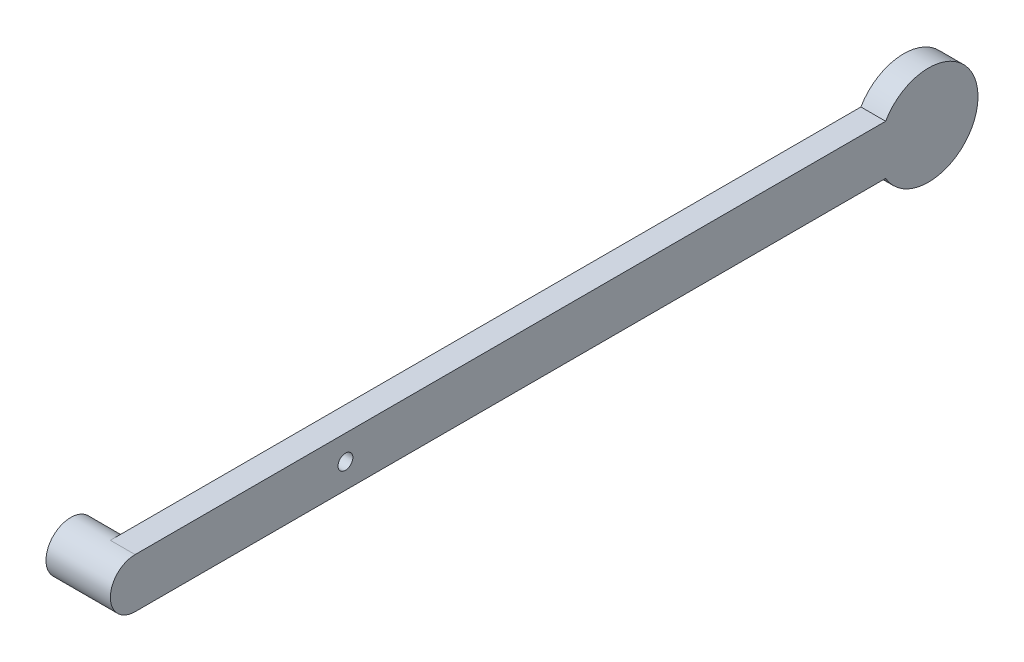
from build123d import *

# Parameters (mm, degrees)
ESBO_O1_R                = 1.5
RESSALTO_EXTRUS_O1_DEPTH = 5
RESSALTO_EXTRUS_O2_START = 8
ESBO_O2_R                = 5
RESSALTO_EXTRUS_O2_DEPTH = 8
ESBO_O3_R                = 10
RESSALTO_EXTRUS_O3_DEPTH = 5


with BuildPart() as part:
    # Esboço1 → Ressalto-extrusão1 (new body)
    with BuildSketch(Plane.YZ):
        with BuildLine():
            Line((5, 42.5), (5, -117.8))
            ThreePointArc((5, -117.8), (0, -122.8), (-5, -117.8))
            Line((-5, -117.8), (-5, 42.5))
            ThreePointArc((-5, 42.5), (0, 47.5), (5, 42.5))
        make_face()
        with Locations(Location((0, 0, 0), (0, 0, 270))):
            Circle(ESBO_O1_R, mode=Mode.SUBTRACT)
    extrude(amount=RESSALTO_EXTRUS_O1_DEPTH)

    # Esboço2 → Ressalto-extrusão2 (add)
    with BuildSketch(Plane(origin=(0, 0, 0), x_dir=(0, -1, 0), z_dir=(-1, 0, 0)).offset(RESSALTO_EXTRUS_O2_START)):
        with Locations(Location((0, 42.5, 0), (0, 0, 90))):
            Circle(ESBO_O2_R)
    extrude(amount=-RESSALTO_EXTRUS_O2_DEPTH)

    # Esboço3 → Ressalto-extrusão3 (add)
    with BuildSketch(Plane(origin=(0, 0, 0), x_dir=(0, -1, 0), z_dir=(-1, 0, 0))):
        with Locations((0, -117.8)):
            Circle(ESBO_O3_R)
    extrude(amount=-RESSALTO_EXTRUS_O3_DEPTH)


solid = part.part
